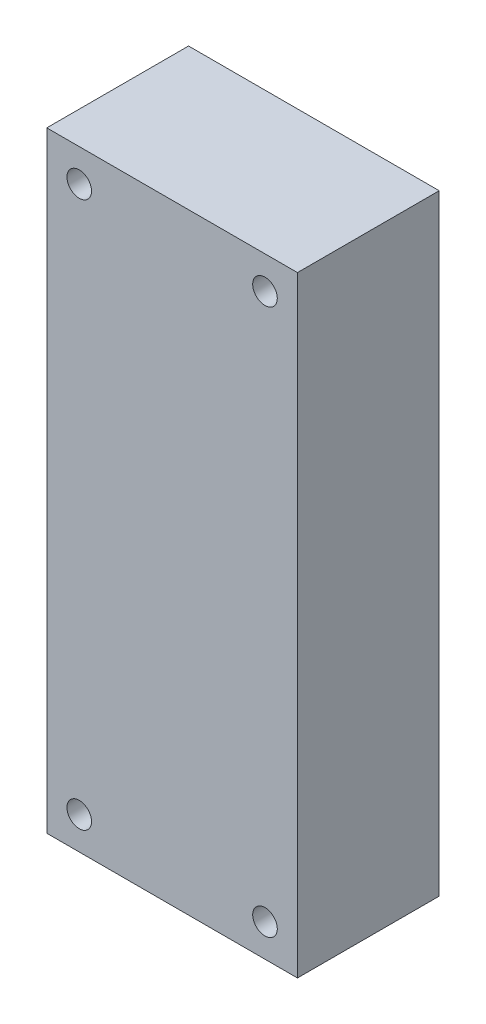
from build123d import *

# Parameters (mm, degrees)
SKETCH_1_W      = 25.48
SKETCH_1_H      = 62.1
SKETCH_1_R      = 1.25
EXTRUDE_1_DEPTH = 14.41


with BuildPart() as part:
    # 草圖1 → 填料-伸長1 (new body)
    with BuildSketch(Plane.XY):
        Rectangle(SKETCH_1_W, SKETCH_1_H)
        with Locations((9.44, 27.75)):
            Circle(SKETCH_1_R, mode=Mode.SUBTRACT)
        with Locations(Location((-9.44, 27.75, 0), (0, 0, 180))):
            Circle(SKETCH_1_R, mode=Mode.SUBTRACT)
        with Locations(Location((9.44, -27.75, 0), (0, 0, 180))):
            Circle(SKETCH_1_R, mode=Mode.SUBTRACT)
        with Locations((-9.44, -27.75)):
            Circle(SKETCH_1_R, mode=Mode.SUBTRACT)
    extrude(amount=EXTRUDE_1_DEPTH)


solid = part.part
